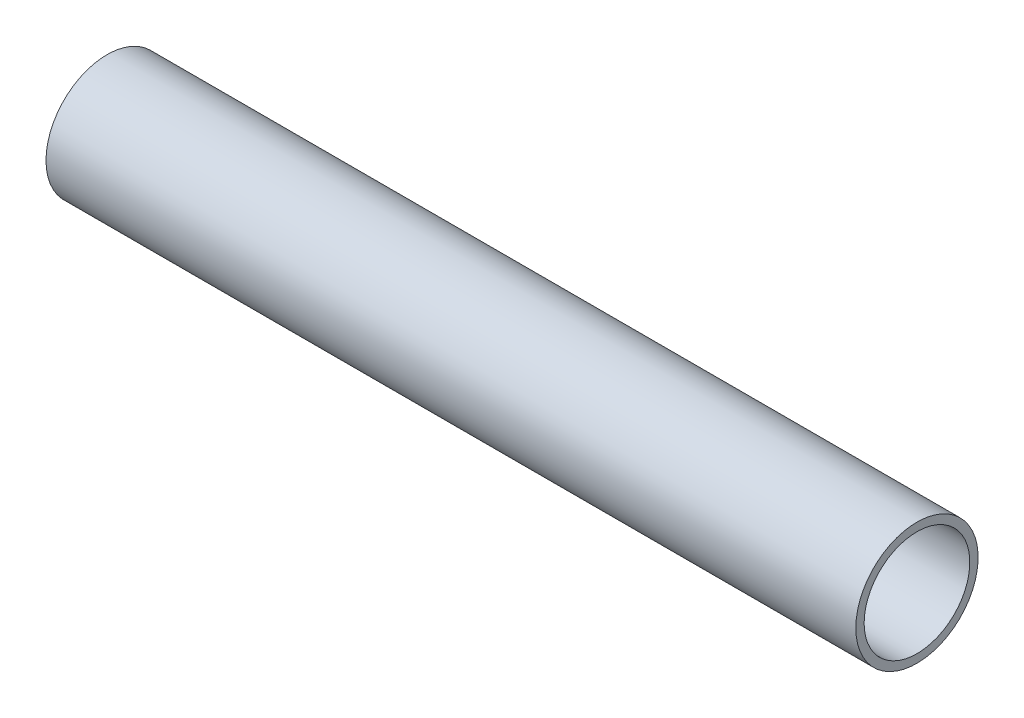
from build123d import *

# Parameters (mm, degrees)
SKETCH1_W = 292
SKETCH1_H = 3


with BuildPart() as part:
    # Sketch1 → Revolve1 (revolve)
    with BuildSketch(Plane.XY, mode=Mode.PRIVATE) as revolve1_sk:
        with Locations((151, 20.55)):
            Rectangle(SKETCH1_W, SKETCH1_H)
    revolve(revolve1_sk.sketch.rotate(Axis((-5.5, 0, 0), (1, 0, 0)), 90), axis=Axis((-5.5, 0, 0), (1, 0, 0)))


solid = part.part
